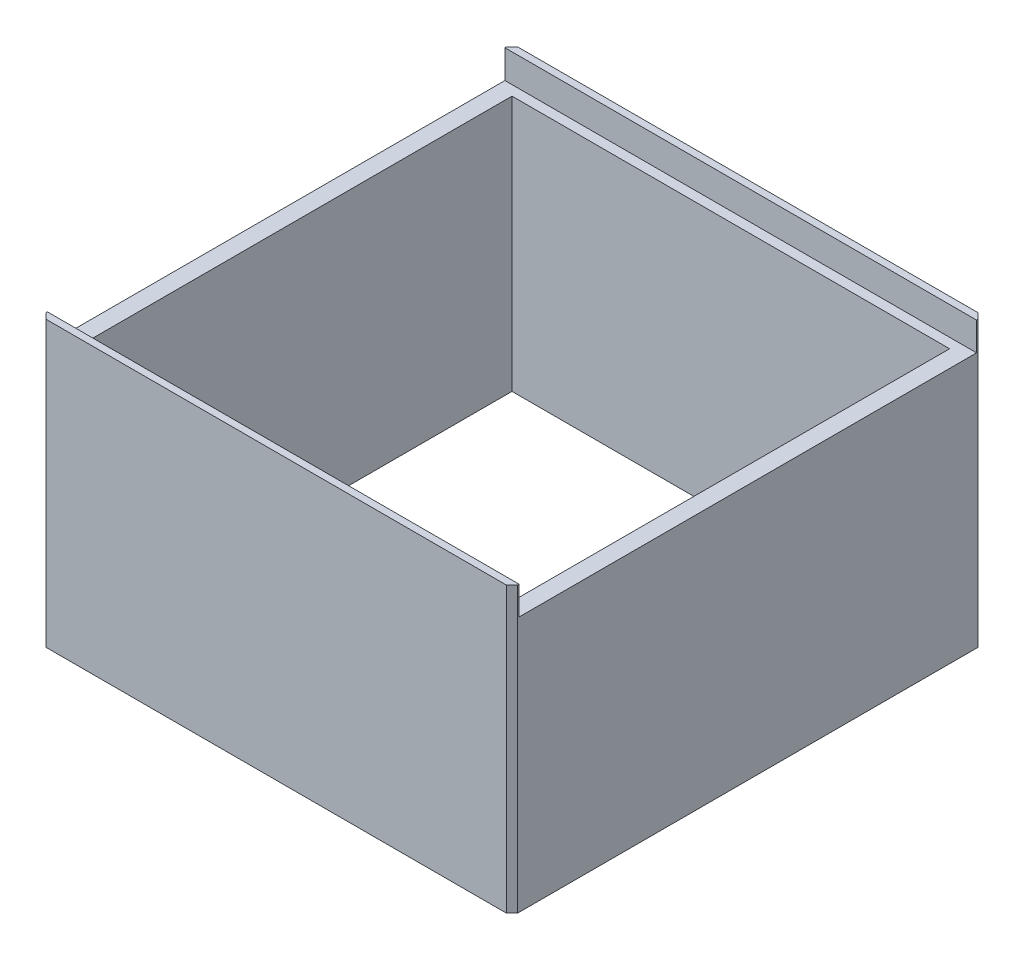
from build123d import *

# Parameters (mm, degrees)
SKETCH1_W           = 83
SKETCH1_H           = 83
SKETCH1_W_2         = 77
SKETCH1_H_2         = 77
BOSS_EXTRUDE1_DEPTH = 50
SKETCH2_W           = 100.5
SKETCH2_H           = 80.5
CUT_EXTRUDE1_DEPTH  = 5
CHAMFER1_SIZE       = 1
SKETCH3_W           = 8
SKETCH3_H           = 8
BOSS_EXTRUDE2_DEPTH = 3


with BuildPart() as part:
    # Sketch1 → Boss-Extrude1 (new body)
    with BuildSketch(Plane(origin=(0, 0, 0), x_dir=(1, 0, 0), z_dir=(0, 1, 0))):
        Rectangle(SKETCH1_W, SKETCH1_H)
        Rectangle(SKETCH1_W_2, SKETCH1_H_2, mode=Mode.SUBTRACT)
    extrude(amount=BOSS_EXTRUDE1_DEPTH)

    # Sketch2 → Cut-Extrude1 (cut)
    with BuildSketch(Plane(origin=(0, 50, 0), x_dir=(1, 0, 0), z_dir=(0, 1, 0))):
        Rectangle(SKETCH2_W, SKETCH2_H)
    extrude(amount=-CUT_EXTRUDE1_DEPTH, mode=Mode.SUBTRACT)

    # Chamfer1
    chamfer1_edges = [part.edges().sort_by_distance(p)[0] for p in [
        (-41.5, 25, -41.5),
        (41.5, 25, -41.5),
        (41.5, 25, 41.5),
        (-41.5, 25, 41.5),
    ]]
    chamfer(chamfer1_edges, length=CHAMFER1_SIZE)

    # Sketch3 → Boss-Extrude2 (add)
    with BuildSketch(Plane(origin=(0, 1, 0), x_dir=(-1, 0, 0), z_dir=(0, -1, 0))):
        with Locations((-34.5, 34.5)):
            Rectangle(SKETCH3_W, SKETCH3_H)
    extrude(amount=-BOSS_EXTRUDE2_DEPTH)


solid = part.part
